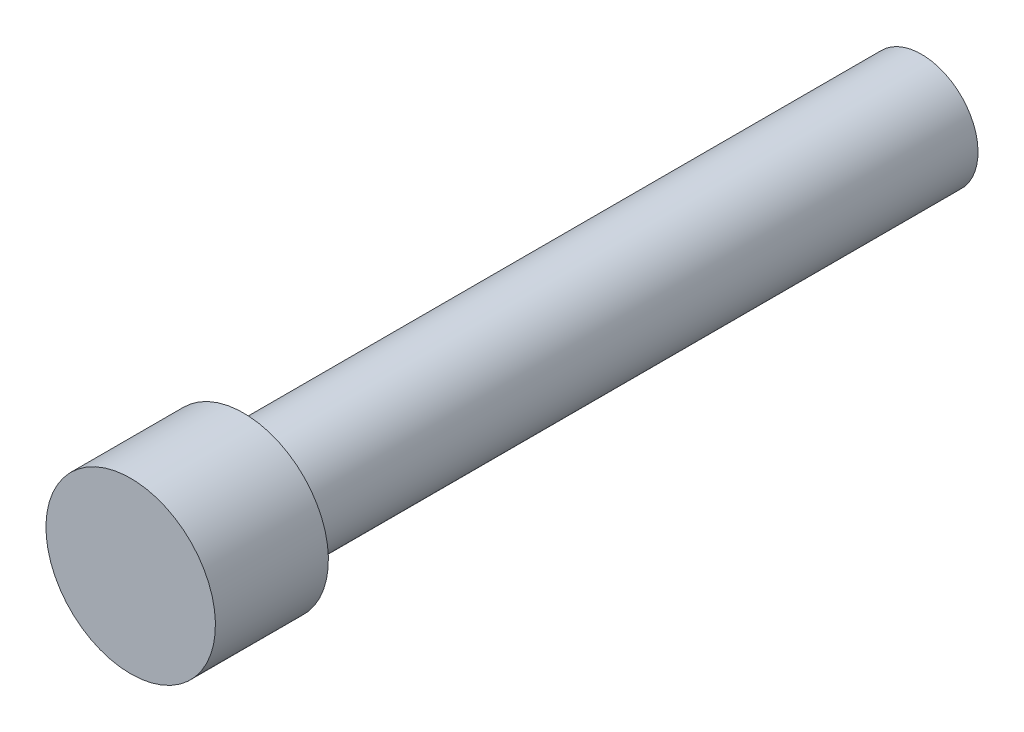
from build123d import *


with BuildPart() as part:
    # Sketch3 → Revolve1 (revolve)
    with BuildSketch(Plane(origin=(0, 0, 0), x_dir=(0, 0, -1), z_dir=(1, 0, 0))):
        Polygon((-22.225, 4.7625), (-22.225, 0), (22.225, 0), (22.225, 3.175), (-15.875, 3.175), (-15.875, 4.7625), align=None)
    revolve(axis=Axis((0, 0, 22.225), (0, 0, -1)))


solid = part.part
